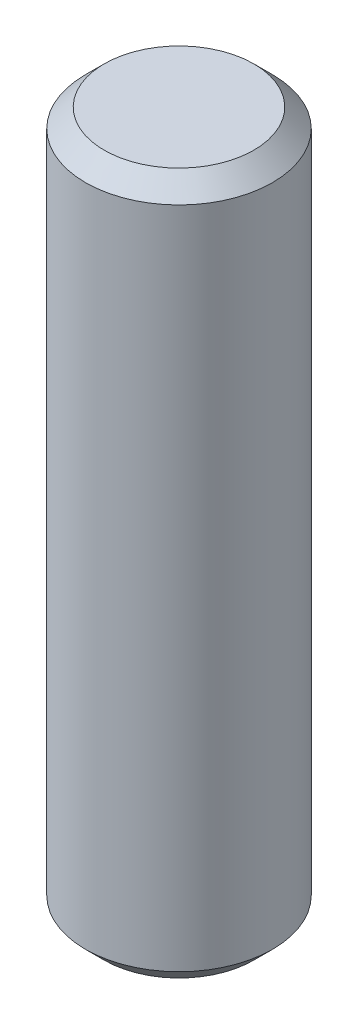
from build123d import *

# Parameters (mm, degrees)
SKETCH1_W     = 10
SKETCH1_H     = 75
CHAMFER1_SIZE = 2


with BuildPart() as part:
    # Sketch1 → Revolve1 (revolve)
    with BuildSketch(Plane.XY, mode=Mode.PRIVATE) as revolve1_sk:
        with Locations((5, -17.589365205)):
            Rectangle(SKETCH1_W, SKETCH1_H)
    revolve(revolve1_sk.sketch.rotate(Axis((0, 25.810082142, 0), (0, -1, 0)), 90), axis=Axis((0, 25.810082142, 0), (0, -1, 0)))

    # Chamfer1
    chamfer1_edges = [part.edges().sort_by_distance(p)[0] for p in [
        (0, -55.089365205, -10),
        (0, 19.910634795, -10),
    ]]
    chamfer(chamfer1_edges, length=CHAMFER1_SIZE)


solid = part.part
